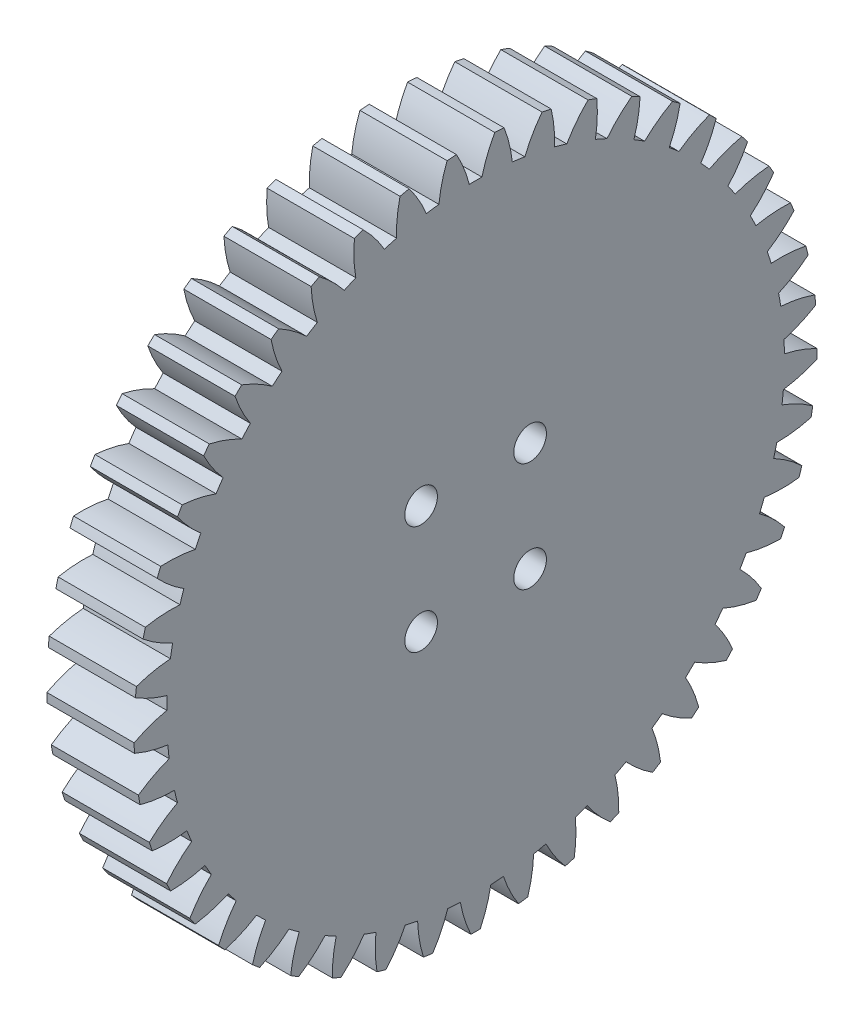
from build123d import *

# Parameters (mm, degrees)
BASPROSKE_W           = 12
BASPROSKE_H           = 47
TOOTHCUT_DEPTH        = 68.542579163
TEETHCUTS_COUNT       = 45
TEETHCUTS_ANGLE       = 352
F_8_CLEARANCE_HOLE1_D = 4.4958


with BuildPart() as part:
    # BasProSke → Base-Revolve (revolve)
    with BuildSketch(Plane(origin=(0, 0, 0), x_dir=(1, 0, 0), z_dir=(0, 1, 0)), mode=Mode.PRIVATE) as base_revolve_sk:
        with Locations((6, 23.5)):
            Rectangle(BASPROSKE_W, BASPROSKE_H)
    revolve(base_revolve_sk.sketch.rotate(Axis((-10, 0, 0), (1, 0, 0)), 180), axis=Axis((-10, 0, 0), (1, 0, 0)))

    # TooCutSke → ToothCut (cut, through all)
    with BuildSketch(Plane(origin=(0, 0, 0), x_dir=(0, 0, -1), z_dir=(1, 0, 0))):
        with BuildLine():
            ThreePointArc((0.870558136, 42.49008272), (0, 42.499), (-0.870558136, 42.49008272))
            ThreePointArc((-0.870558136, 42.49008272), (-1.611306544, 44.779997814), (-2.650928503, 46.950621117))
            ThreePointArc((-2.650928503, 46.950621117), (0, 47.0254), (2.650928503, 46.950621117))
            ThreePointArc((2.650928503, 46.950621117), (1.611306544, 44.779997814), (0.870558136, 42.49008272))
        make_face()
    toothcut = extrude(amount=TOOTHCUT_DEPTH, mode=Mode.SUBTRACT)

    # TeethCuts: ToothCut ×45 about axis
    teethcuts_axis = Axis((-10, 0, 0), (1, 0, 0))
    for i in range(1, TEETHCUTS_COUNT):
        add(toothcut.rotate(teethcuts_axis, i * TEETHCUTS_ANGLE / (TEETHCUTS_COUNT - 1)), mode=Mode.SUBTRACT)

    # #8 Clearance Hole1 (through all)
    with Locations(Plane(origin=(12, 0, 0), x_dir=(0, 0, -1), z_dir=(1, 0, 0))):
        with Locations((7.5, 7.5), (7.5, -7.5), (-7.5, -7.5), (-7.5, 7.5)):
            Hole(F_8_CLEARANCE_HOLE1_D / 2)


solid = part.part
